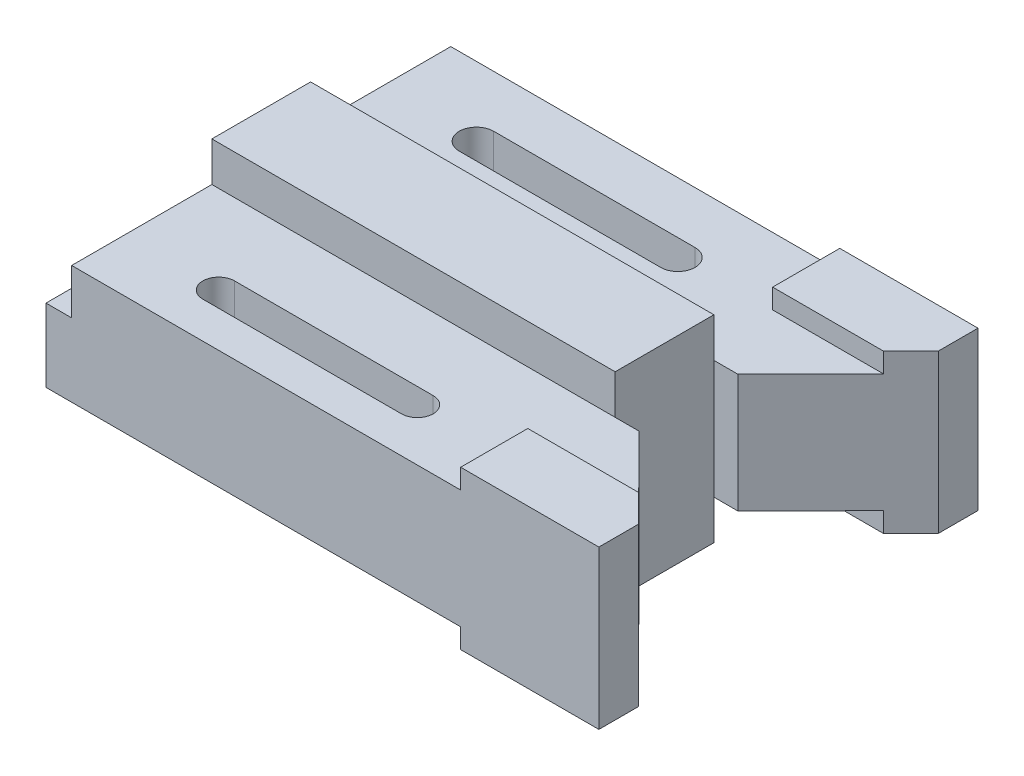
from build123d import *

# Parameters (mm, degrees)
BOSS_EXTRUDE3_DEPTH     = 30
SKETCH3_W               = 108.623523344
SKETCH3_H               = 25
BOSS_EXTRUDE4_DEPTH     = 10
CUT_EXTRUDE2_DEPTH      = 152.009933448
CUT_EXTRUDE2_DEPTH_BACK = 152.009933448
SKETCH5_W               = 108.623523344
SKETCH5_H               = 25
BOSS_EXTRUDE5_DEPTH     = 10
CUT_EXTRUDE3_DEPTH      = 154.310143174
CUT_EXTRUDE3_DEPTH_BACK = 154.310143174
BOSS_EXTRUDE6_DEPTH     = 5
BOSS_EXTRUDE7_DEPTH     = 5
BOSS_EXTRUDE8_DEPTH     = 5
CUT_EXTRUDE4_REACH      = 176.402
SKETCH22_W              = 6.5
SKETCH22_H              = 11.5
SKETCH23_W              = 6.5
SKETCH23_H              = 10
CUT_EXTRUDE5_DEPTH      = 158.671335378


with BuildPart() as part:
    # Sketch1 → Boss-Extrude3 (new body)
    with BuildSketch(Plane(origin=(0, 0, 0), x_dir=(1, 0, 0), z_dir=(0, 1, 0))):
        Polygon((0, -48), (105, -48), (140, -48), (140, -38), (114.68589492, -12.5), (108.623523344, -12.5), (108.623523344, 12.5), (114.68589492, 12.5), (140, 38), (140, 48), (0, 48), align=None)
    extrude(amount=BOSS_EXTRUDE3_DEPTH)

    # Sketch3 → Boss-Extrude4 (add)
    with BuildSketch(Plane(origin=(0, 30, 0), x_dir=(1, 0, 0), z_dir=(0, 1, 0))):
        with Locations((54.311761672, 0)):
            Rectangle(SKETCH3_W, SKETCH3_H)
    extrude(amount=BOSS_EXTRUDE4_DEPTH)

    # Sketch4 → Cut-Extrude2 (cut, two sides: drawn at the far end of the back side and taken through both)
    with BuildSketch(Plane(origin=(0, 30, 0), x_dir=(1, 0, 0), z_dir=(0, 1, 0)).offset(-CUT_EXTRUDE2_DEPTH_BACK)):
        with BuildLine():
            Line((30.5, 34.860728985), (81.5, 34.860728985))
            ThreePointArc((81.5, 34.860728985), (85.860728985, 30.5), (81.5, 26.139271015))
            Line((81.5, 26.139271015), (30.5, 26.139271015))
            ThreePointArc((30.5, 26.139271015), (26.139271015, 30.5), (30.5, 34.860728985))
        make_face()
    extrude(amount=CUT_EXTRUDE2_DEPTH + CUT_EXTRUDE2_DEPTH_BACK, mode=Mode.SUBTRACT)

    # Sketch5 → Boss-Extrude5 (add)
    with BuildSketch(Plane.XZ):
        with Locations((54.311761672, 0)):
            Rectangle(SKETCH5_W, SKETCH5_H)
    extrude(amount=BOSS_EXTRUDE5_DEPTH)

    # Sketch6 → Cut-Extrude3 (cut, two sides: drawn at the far end of the back side and taken through both)
    with BuildSketch(Plane.XZ.offset(-CUT_EXTRUDE3_DEPTH_BACK)):
        with BuildLine():
            Line((30.5, 38.784818055), (80.79497918, 38.784818055))
            ThreePointArc((80.79497918, 38.784818055), (84.804542876, 34.77525436), (80.79497918, 30.765690664))
            Line((80.79497918, 30.765690664), (30.5, 30.765690664))
            ThreePointArc((30.5, 30.765690664), (26.490436304, 34.77525436), (30.5, 38.784818055))
        make_face()
    extrude(amount=CUT_EXTRUDE3_DEPTH + CUT_EXTRUDE3_DEPTH_BACK, mode=Mode.SUBTRACT)

    # Sketch10 → Boss-Extrude6 (add)
    with BuildSketch(Plane(origin=(0, 30, 0), x_dir=(1, 0, 0), z_dir=(0, 1, 0))):
        Polygon((140, 48), (105, 48), (105, 31), (133.051029978, 31), (140, 38), align=None)
    extrude(amount=BOSS_EXTRUDE6_DEPTH)

    # Sketch12 → Boss-Extrude7 (add)
    with BuildSketch(Plane.XZ):
        Polygon((140, 48), (105, 48), (105, 31), (133.051029978, 31), (140, 38), align=None)
        Polygon((105, -48), (105, -31), (133.051029978, -31), (140, -38), (140, -48), align=None)
    extrude(amount=BOSS_EXTRUDE7_DEPTH)

    # Sketch13 → Boss-Extrude8 (add)
    with BuildSketch(Plane(origin=(0, 30, 0), x_dir=(1, 0, 0), z_dir=(0, 1, 0))):
        Polygon((105, -48), (105, -31), (133.051029978, -31), (140, -38), (140, -48), align=None)
    extrude(amount=BOSS_EXTRUDE8_DEPTH)

    # Sketch22 → Cut-Extrude4 (cut, up to next)
    with BuildSketch(Plane(origin=(0, 0, -48), x_dir=(-1, 0, 0), z_dir=(0, 0, -1)), mode=Mode.PRIVATE) as cut_extrude4_sk1:
        with Locations((-3.25, 24.25)):
            Rectangle(SKETCH22_W, SKETCH22_H)
    cut_extrude4_tool1 = extrude(cut_extrude4_sk1.sketch, amount=-CUT_EXTRUDE4_REACH, mode=Mode.PRIVATE) & part.part
    add(cut_extrude4_tool1.solids().sort_by_distance((3.25, 24.25, -48))[0], mode=Mode.SUBTRACT)

    # Sketch23 → Cut-Extrude5 (cut, through all)
    with BuildSketch(Plane(origin=(0, 0, -12.5), x_dir=(-1, 0, 0), z_dir=(0, 0, -1))):
        with Locations((-3.25, 35)):
            Rectangle(SKETCH23_W, SKETCH23_H)
    extrude(amount=-CUT_EXTRUDE5_DEPTH, mode=Mode.SUBTRACT)


solid = part.part
